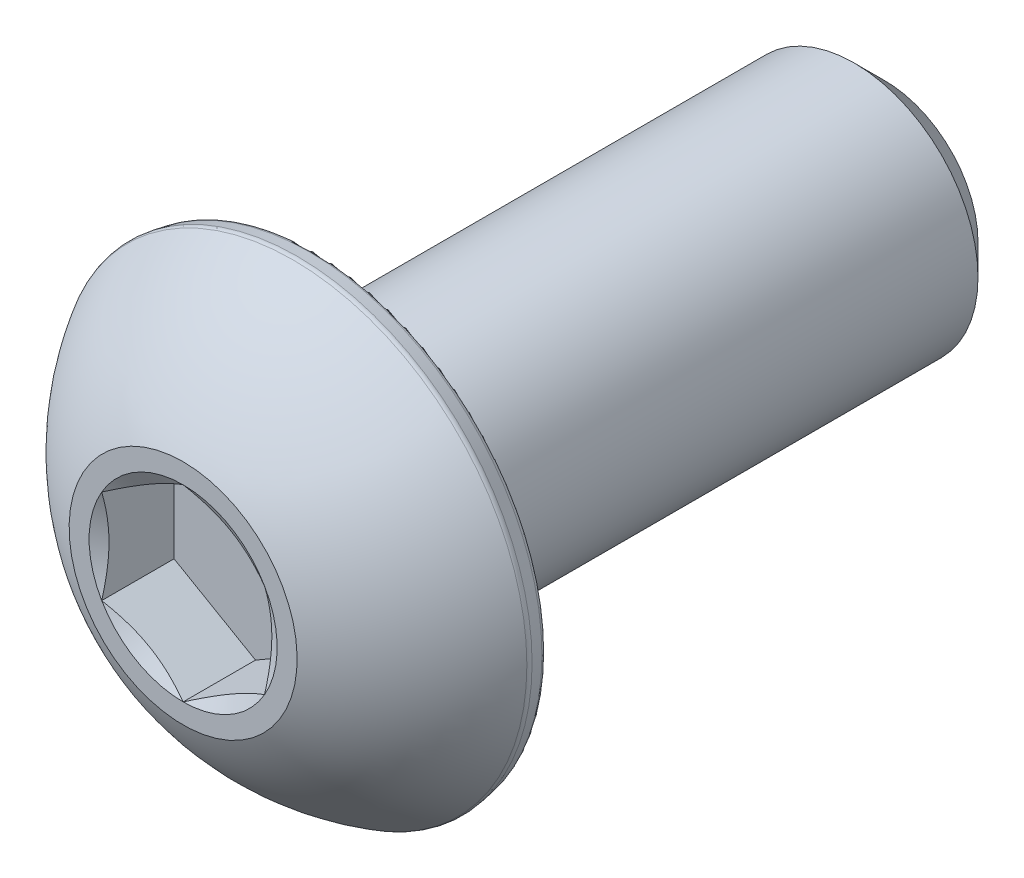
from build123d import *

# Parameters (mm, degrees)
CUT_EXTRUDE1_DEPTH = 1.41097
FILLET1_R          = 0.12827


with BuildPart() as part:
    # Sketch3 → Revolve1 (revolve)
    with BuildSketch(Plane(origin=(0, 0, 0), x_dir=(0, 0, -1), z_dir=(1, 0, 0)), mode=Mode.PRIVATE) as revolve1_sk:
        with BuildLine():
            Line((-6.83895, 0), (-6.83895, 2.2225))
            ThreePointArc((-6.83895, 2.2225), (-5.93321038, 3.573966445), (-4.65836, 4.5847))
            Line((-4.65836, 4.5847), (-4.27355, 4.516847615))
            Line((-4.27355, 4.516847615), (-4.27355, 2.413))
            Line((-4.27355, 2.413), (6.2436375, 2.413))
            Line((6.2436375, 2.413), (6.83895, 1.8176875))
            Line((6.83895, 1.8176875), (6.83895, 0))
            Line((6.83895, 0), (-6.83895, 0))
        make_face()
    revolve(revolve1_sk.sketch.rotate(Axis((0, 0, 6.83895), (0, 0, -1)), 90), axis=Axis((0, 0, 6.83895), (0, 0, -1)))

    # Sketch4 → Cut-Extrude1 (cut)
    with BuildSketch(Plane.XY.offset(6.83895)):
        Polygon((-1.5875, -0.916543552), (0, -1.833087105), (1.5875, -0.916543552), (1.5875, 0.916543552), (0, 1.833087105), (-1.5875, 0.916543552), align=None)
    extrude(amount=-CUT_EXTRUDE1_DEPTH, mode=Mode.SUBTRACT)

    # Cut-Extrude2 cone 1 section (through the dimple's axis) → Cut-Extrude2 (revolve, cut)
    with BuildSketch(Plane(origin=(0, 0, 6.83895), x_dir=(0, -1, 0), z_dir=(1, 0, 0))):
        Polygon((0, 0), (1.833087105, 0), (0, 1.058333333), align=None)
    revolve(axis=Axis((0, 0, 6.83895), (0, 0, -1)), mode=Mode.SUBTRACT)

    # Fillet1
    fillet1_edges = [part.edges().sort_by_distance(p)[0] for p in [
        (-4.516847615, 0, 4.27355),
        (-4.5847, 0, 4.65836),
    ]]
    fillet(fillet1_edges, radius=FILLET1_R)


solid = part.part
